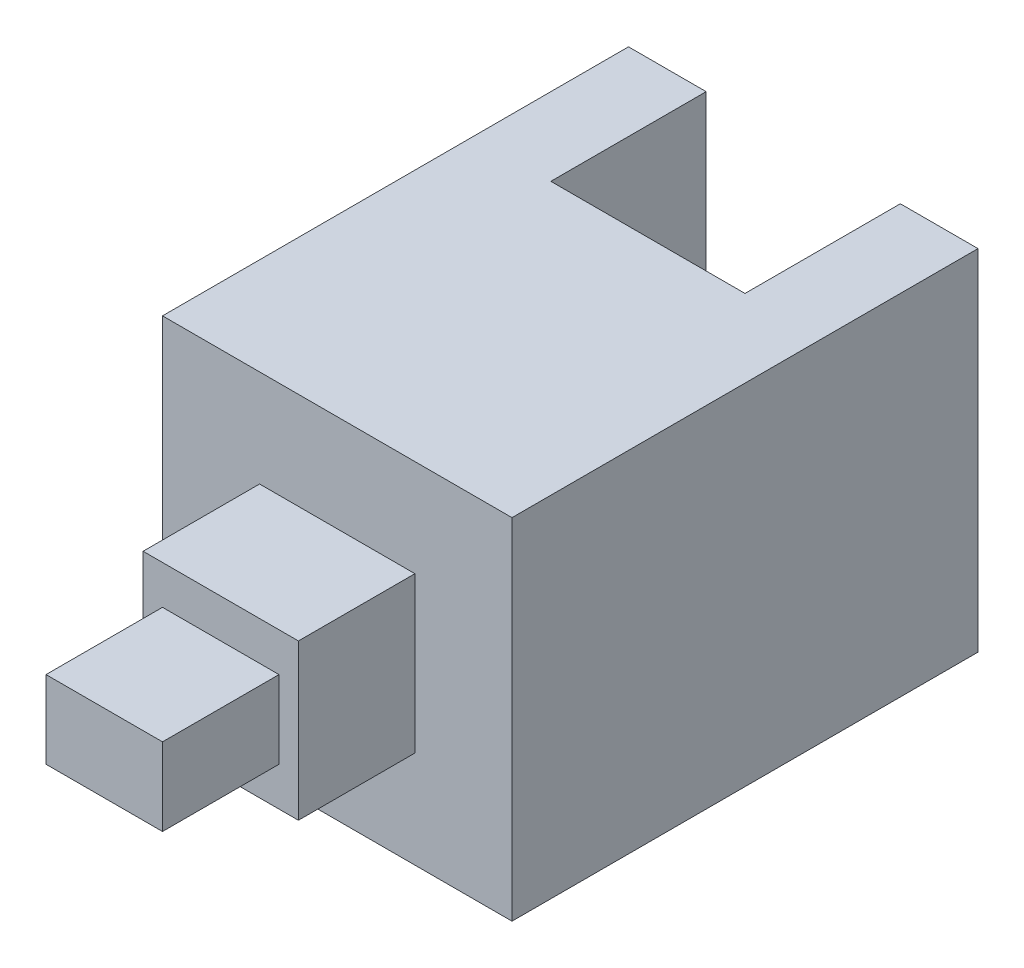
from build123d import *

# Parameters (mm, degrees)
SKETCH1_W           = 9
SKETCH1_H           = 9
MAIN_BODY_DEPTH     = 8
SKETCH2_W           = 4
SKETCH2_H           = 4
BOSS_EXTRUDE2_DEPTH = 3
SKETCH3_W           = 3
SKETCH3_H           = 2
BOSS_EXTRUDE3_DEPTH = 3
SKETCH4_W           = 2
SKETCH4_H           = 9
PINS_DEPTH          = 4


with BuildPart() as part:
    # Sketch1 → MAIN BODY (new body)
    with BuildSketch(Plane.XY):
        Rectangle(SKETCH1_W, SKETCH1_H)
    extrude(amount=MAIN_BODY_DEPTH)

    # Sketch2 → Boss-Extrude2 (add)
    with BuildSketch(Plane.XY.offset(8)):
        Rectangle(SKETCH2_W, SKETCH2_H)
    extrude(amount=BOSS_EXTRUDE2_DEPTH)

    # Sketch3 → Boss-Extrude3 (add)
    with BuildSketch(Plane.XY.offset(11)):
        Rectangle(SKETCH3_W, SKETCH3_H)
    extrude(amount=BOSS_EXTRUDE3_DEPTH)

    # Sketch4 → PINS (add)
    with BuildSketch(Plane(origin=(0, 0, 0), x_dir=(-1, 0, 0), z_dir=(0, 0, -1))):
        with Locations((-3.5, 0)):
            Rectangle(SKETCH4_W, SKETCH4_H)
        with Locations((3.5, 0)):
            Rectangle(SKETCH4_W, SKETCH4_H)
    extrude(amount=PINS_DEPTH)


solid = part.part
